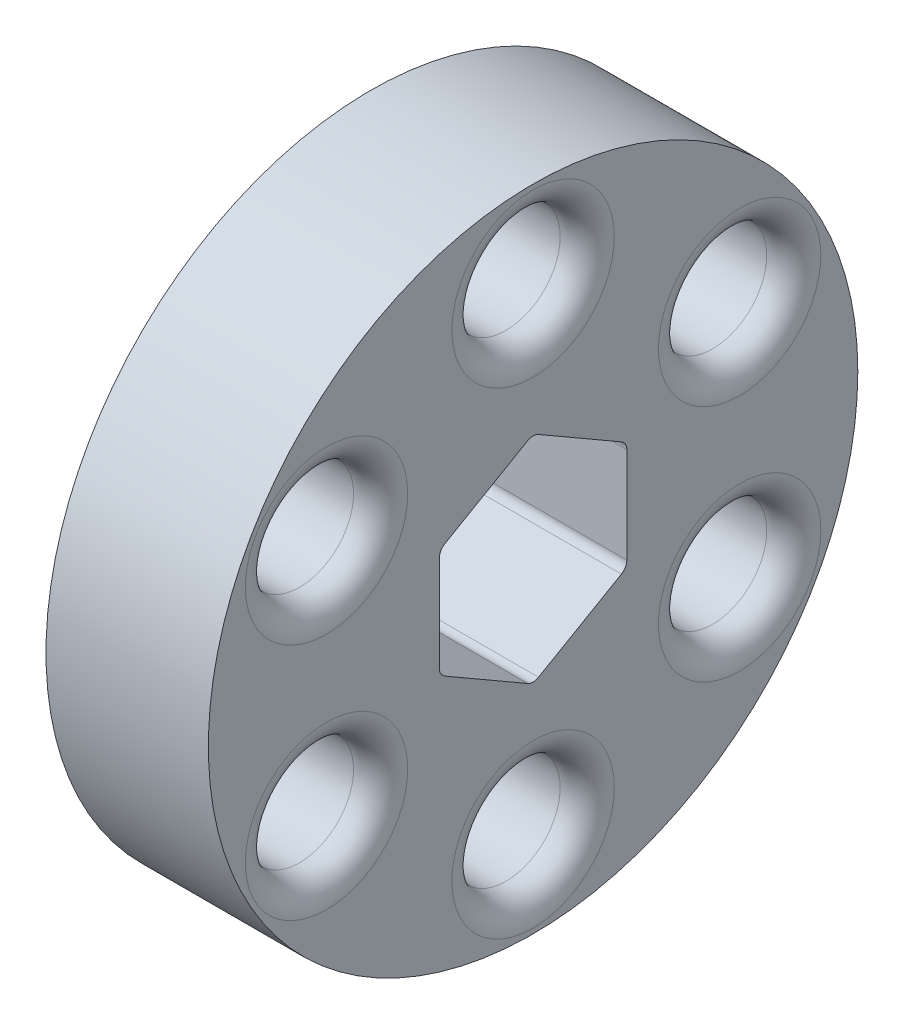
from build123d import *

# Parameters (mm, degrees)
ESBO_O1_R                = 30
RESSALTO_EXTRUS_O1_DEPTH = 15
ESBO_O2_R                = 5
CORTE_EXTRUS_O3_DEPTH    = 46
FILETE1_R                = 2.5
FILETE2_R                = 1


with BuildPart() as part:
    # Esboço1 → Ressalto-extrusão1 (new body)
    with BuildSketch(Plane(origin=(0, 0, 0), x_dir=(0, 0, -1), z_dir=(1, 0, 0))):
        Circle(ESBO_O1_R)
    extrude(amount=RESSALTO_EXTRUS_O1_DEPTH)

    # Esboço2 → Corte-extrusão3 (cut, through all)
    with BuildSketch(Plane(origin=(15, 0, 0), x_dir=(0, 0, -1), z_dir=(1, 0, 0))):
        with Locations((0, 22.035683849)):
            Circle(ESBO_O2_R)
        with Locations((19.083462003, 11.017841924)):
            Circle(ESBO_O2_R)
        with Locations((19.083462003, -11.017841924)):
            Circle(ESBO_O2_R)
        with Locations((0, -22.035683849)):
            Circle(ESBO_O2_R)
        with Locations((-19.083462003, -11.017841924)):
            Circle(ESBO_O2_R)
        with Locations((-19.083462003, 11.017841924)):
            Circle(ESBO_O2_R)
        Polygon((0, 10), (-8.660254038, 5), (-8.660254038, -5), (0, -10), (8.660254038, -5), (8.660254038, 5), align=None)
    extrude(amount=-CORTE_EXTRUS_O3_DEPTH, mode=Mode.SUBTRACT)

    # Filete1
    filete1_edges = [part.edges().sort_by_distance(p)[0] for p in [
        (0, 11.017841924, 24.083462003),
        (15, 11.017841924, 24.083462003),
        (0, -11.017841924, 24.083462003),
        (15, -11.017841924, 24.083462003),
        (0, -22.035683849, 5),
        (15, -22.035683849, 5),
        (0, -11.017841924, -14.083462003),
        (15, -11.017841924, -14.083462003),
        (0, 11.017841924, -14.083462003),
        (15, 11.017841924, -14.083462003),
        (0, 22.035683849, 5),
        (15, 22.035683849, 5),
    ]]
    fillet(filete1_edges, radius=FILETE1_R)

    # Filete2
    filete2_edges = [part.edges().sort_by_distance(p)[0] for p in [
        (7.5, 10, 0),
        (7.5, 5, -8.660254038),
        (7.5, -5, -8.660254038),
        (7.5, -10, 0),
        (7.5, -5, 8.660254038),
        (7.5, 5, 8.660254038),
    ]]
    fillet(filete2_edges, radius=FILETE2_R)


solid = part.part
